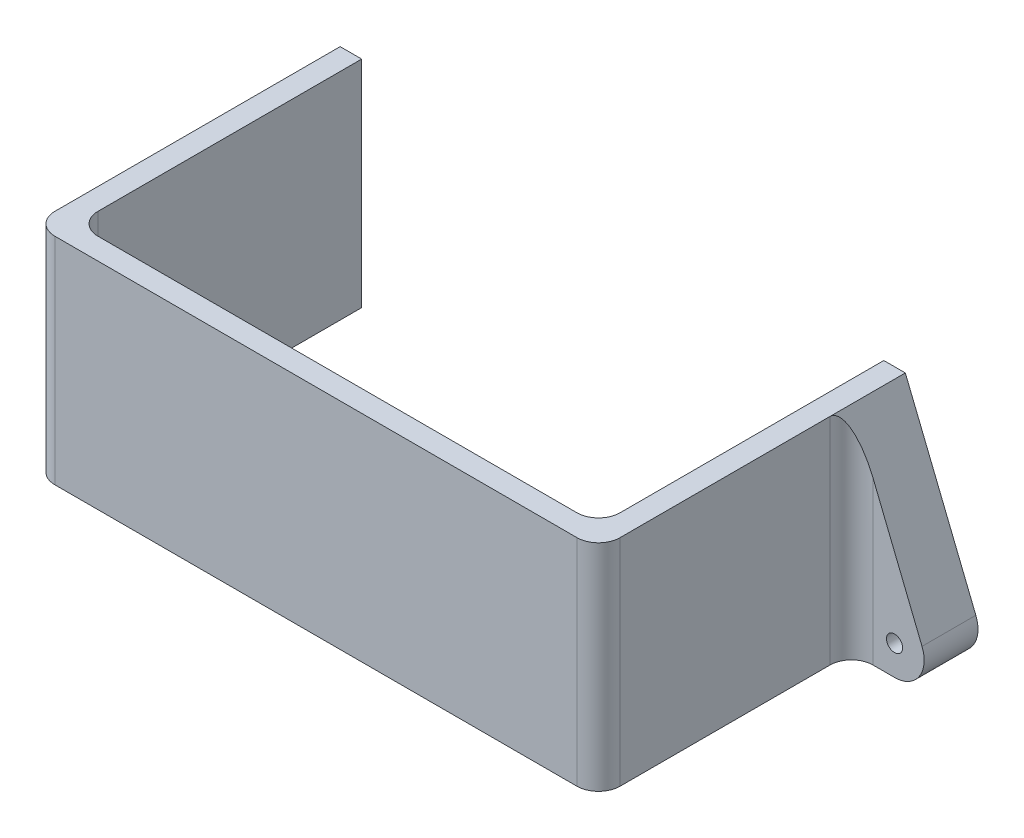
from build123d import *

# Parameters (mm, degrees)
BOSS_EXTRUDE1_DEPTH = 20
FILLET1_R           = 2
SKETCH2_R           = 0.75
BOSS_EXTRUDE2_DEPTH = 5
FILLET2_R           = 2


with BuildPart() as part:
    # Sketch1 → Boss-Extrude1 (new body)
    with BuildSketch(Plane(origin=(0, 0, 0), x_dir=(1, 0, 0), z_dir=(0, 1, 0))):
        Polygon((26.25, 13.25), (26.25, -15.25), (-26.25, -15.25), (-26.25, 13.25), (-24.25, 13.25), (-24.25, -13.25), (24.25, -13.25), (24.25, 13.25), align=None)
    extrude(amount=BOSS_EXTRUDE1_DEPTH)

    # Fillet1
    fillet1_edges = [part.edges().sort_by_distance(p)[0] for p in [
        (-24.25, 10, 13.25),
        (24.25, 10, 13.25),
        (26.25, 10, 15.25),
        (-26.25, 10, 15.25),
    ]]
    fillet(fillet1_edges, radius=FILLET1_R)

    # Sketch2 → Boss-Extrude2 (add)
    with BuildSketch(Plane(origin=(0, 0, -13.25), x_dir=(-1, 0, 0), z_dir=(0, 0, -1))):
        with BuildLine():
            Line((-26.25, 0), (-30.25, 0))
            ThreePointArc((-30.25, 0), (-32.529711414, 1.212009145), (-32.799945678, 3.779697548))
            Line((-32.799945678, 3.779697548), (-26.25, 20))
            Line((-26.25, 20), (-26.25, 0))
        make_face()
        with Locations((-30.25, 2.75)):
            Circle(SKETCH2_R, mode=Mode.SUBTRACT)
    boss_extrude2 = extrude(amount=-BOSS_EXTRUDE2_DEPTH)

    # Mirror1: Boss-Extrude2 across plane
    add(boss_extrude2.mirror(Plane(origin=(0, 0, 0), x_dir=(0, 0, 1), z_dir=(1, 0, 0))))

    # Fillet2
    fillet2_edges = [part.edges().sort_by_distance(p)[0] for p in [
        (26.25, 10, -8.25),
        (-26.25, 10, -8.25),
    ]]
    fillet(fillet2_edges, radius=FILLET2_R)


solid = part.part
